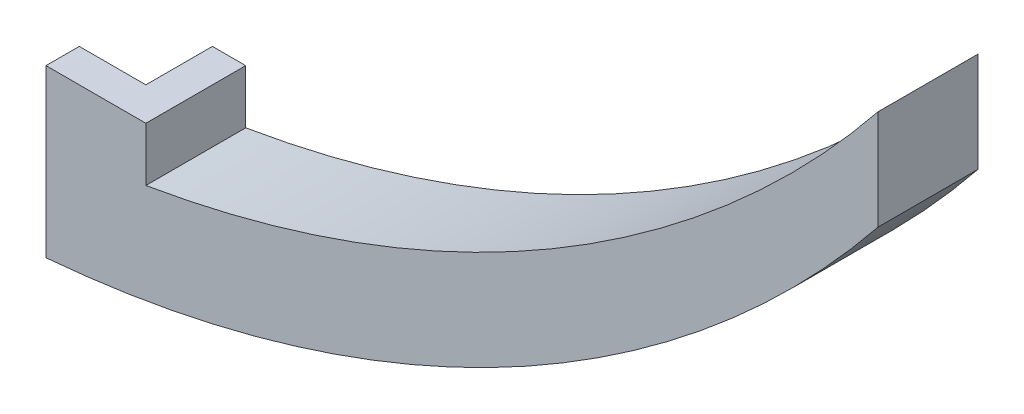
from build123d import *

# Parameters (mm, degrees)
AUFSATZ_LINEAR_AUSTRAGEN1_DEPTH = 30
SKIZZE2_W                       = 20
SKIZZE2_H                       = 20
SCHNITT_LINEAR_AUSTRAGEN1_DEPTH = 10
SKIZZE3_W                       = 20
SKIZZE3_H                       = 20
AUFSATZ_LINEAR_AUSTRAGEN2_DEPTH = 10
SKIZZE4_W                       = 30
SKIZZE4_H                       = 17.744362141
AUFSATZ_LINEAR_AUSTRAGEN4_DEPTH = 10


with BuildPart() as part:
    # Skizze1 → Aufsatz-Linear austragen1 (new body)
    with BuildSketch(Plane.XY):
        with BuildLine():
            Line((0, 0), (0, 30))
            ThreePointArc((0, 30), (138.640100071, 70.863285882), (250, 163.003712235))
            Line((250, 163.003712235), (250, 133.003712235))
            ThreePointArc((250, 133.003712235), (138.640100071, 40.863285882), (0, 0))
        make_face()
    extrude(amount=AUFSATZ_LINEAR_AUSTRAGEN1_DEPTH)

    # Skizze2 → Schnitt-Linear austragen1 (cut)
    with BuildSketch(Plane(origin=(0, 30, 0), x_dir=(1, 0, 0), z_dir=(0, 1, 0))):
        with Locations((10, -10)):
            Rectangle(SKIZZE2_W, SKIZZE2_H)
    extrude(amount=SCHNITT_LINEAR_AUSTRAGEN1_DEPTH, mode=Mode.SUBTRACT)

    # Skizze3 → Aufsatz-Linear austragen2 (add)
    with BuildSketch(Plane.XY.offset(30)):
        with Locations((10, 40)):
            Rectangle(SKIZZE3_W, SKIZZE3_H)
    extrude(amount=-AUFSATZ_LINEAR_AUSTRAGEN2_DEPTH)

    # Skizze4 → Aufsatz-Linear austragen4 (add)
    with BuildSketch(Plane.ZY.offset(-20)):
        with Locations((15, 41.12781893)):
            Rectangle(SKIZZE4_W, SKIZZE4_H)
    extrude(amount=-AUFSATZ_LINEAR_AUSTRAGEN4_DEPTH)


solid = part.part
